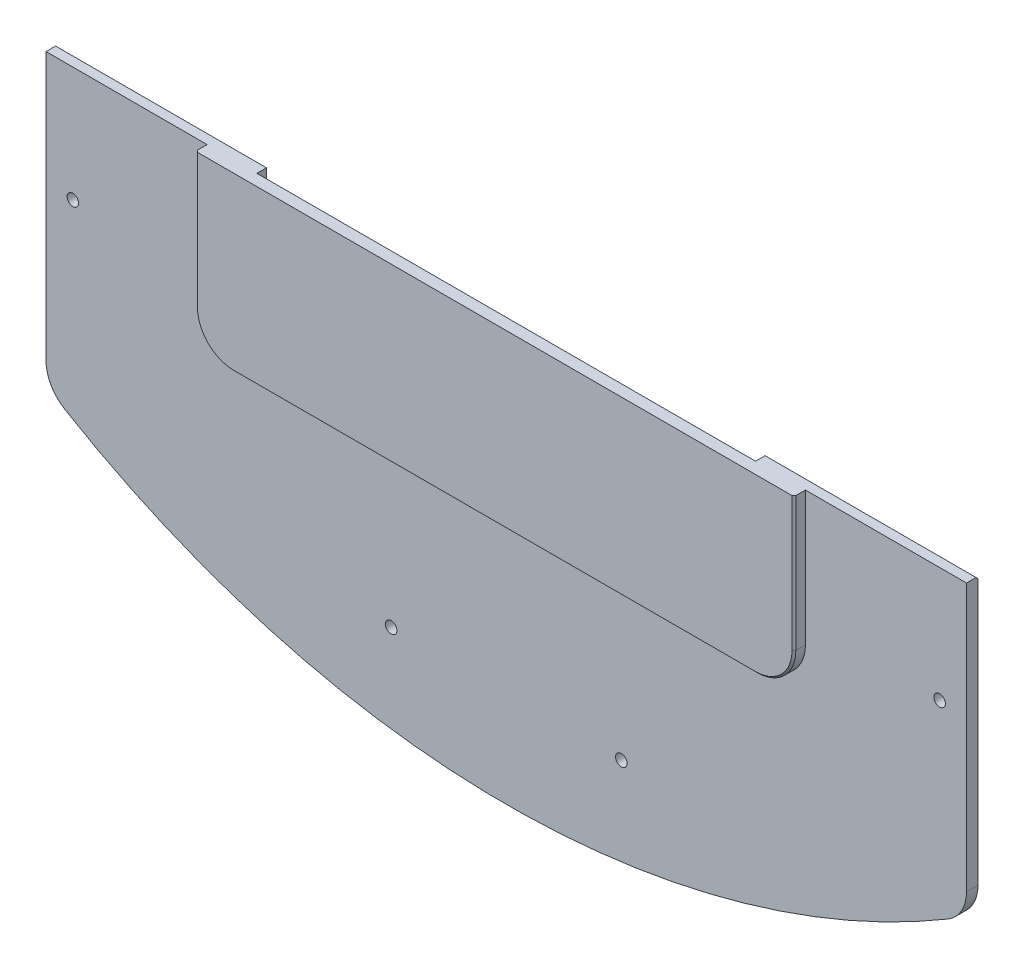
from build123d import *

# Parameters (mm, degrees)
EXTRUDE_1_DEPTH     = 3
SKETCH_2_W          = 156
SKETCH_2_H          = 45
EXTRUDE_2_DEPTH     = 3
SKETCH_3_R          = 1.5
CUT_EXTRUDE_1_DEPTH = 3
SKETCH_4_W          = 130
SKETCH_4_H          = 20
CUT_EXTRUDE_2_DEPTH = 3
FILLET_1_R          = 10
CHAMFER_1_SIZE      = 0.5
FILLET_2_R          = 10
CHAMFER_2_SIZE      = 0.5


with BuildPart() as part:
    # 草图1 → 凸台-拉伸1 (new body)
    with BuildSketch(Plane.XY):
        with BuildLine():
            Line((-120, -15), (120, -15))
            Line((120, -15), (120, -90.328663107))
            ThreePointArc((120, -90.328663107), (0, -125), (-120, -90.328663107))
            Line((-120, -90.328663107), (-120, -15))
        make_face()
    extrude(amount=EXTRUDE_1_DEPTH)

    # 草图2 → 凸台-拉伸2 (add)
    with BuildSketch(Plane.XY.offset(3)):
        with Locations((0, -37.5)):
            Rectangle(SKETCH_2_W, SKETCH_2_H)
    extrude(amount=EXTRUDE_2_DEPTH)

    # 草图3 → 切除-拉伸1 (cut)
    with BuildSketch(Plane(origin=(0, 0, 0), x_dir=(-1, 0, 0), z_dir=(0, 0, -1))):
        with Locations((30, -100)):
            Circle(SKETCH_3_R)
        with Locations((113, -45)):
            Circle(SKETCH_3_R)
        with Locations(Location((-113, -45, 0), (0, 0, 180))):
            Circle(SKETCH_3_R)
        with Locations(Location((-30, -100, 0), (0, 0, 180))):
            Circle(SKETCH_3_R)
    extrude(amount=-CUT_EXTRUDE_1_DEPTH, mode=Mode.SUBTRACT)

    # 草图4 → 切除-拉伸2 (cut)
    with BuildSketch(Plane(origin=(0, 0, 0), x_dir=(-1, 0, 0), z_dir=(0, 0, -1))):
        with Locations((0, -25)):
            Rectangle(SKETCH_4_W, SKETCH_4_H)
    extrude(amount=-CUT_EXTRUDE_2_DEPTH, mode=Mode.SUBTRACT)

    # 圆角1
    fillet_1_edges = [part.edges().sort_by_distance(p)[0] for p in [
        (120, -90.328663107, 1.5),
        (-120, -90.328663107, 1.5),
    ]]
    fillet(fillet_1_edges, radius=FILLET_1_R)

    # 倒角1
    chamfer_1_edges = [part.edges().sort_by_distance(p)[0] for p in [
        (-92.5, -15, 0),
        (92.5, -15, 0),
        (65, -25, 0),
        (0, -35, 0),
        (-65, -25, 0),
    ]]
    chamfer(chamfer_1_edges, length=CHAMFER_1_SIZE)

    # 圆角2
    fillet_2_edges = [part.edges().sort_by_distance(p)[0] for p in [
        (-78, -60, 4.5),
        (78, -60, 4.5),
    ]]
    fillet(fillet_2_edges, radius=FILLET_2_R)

    # 倒角2
    chamfer_2_edges = [part.edges().sort_by_distance(p)[0] for p in [
        (-75.071067812, -57.071067812, 6),
        (-78, -32.5, 6),
        (0, -60, 6),
        (78, -32.5, 6),
        (75.071067812, -57.071067812, 6),
    ]]
    chamfer(chamfer_2_edges, length=CHAMFER_2_SIZE)


solid = part.part
